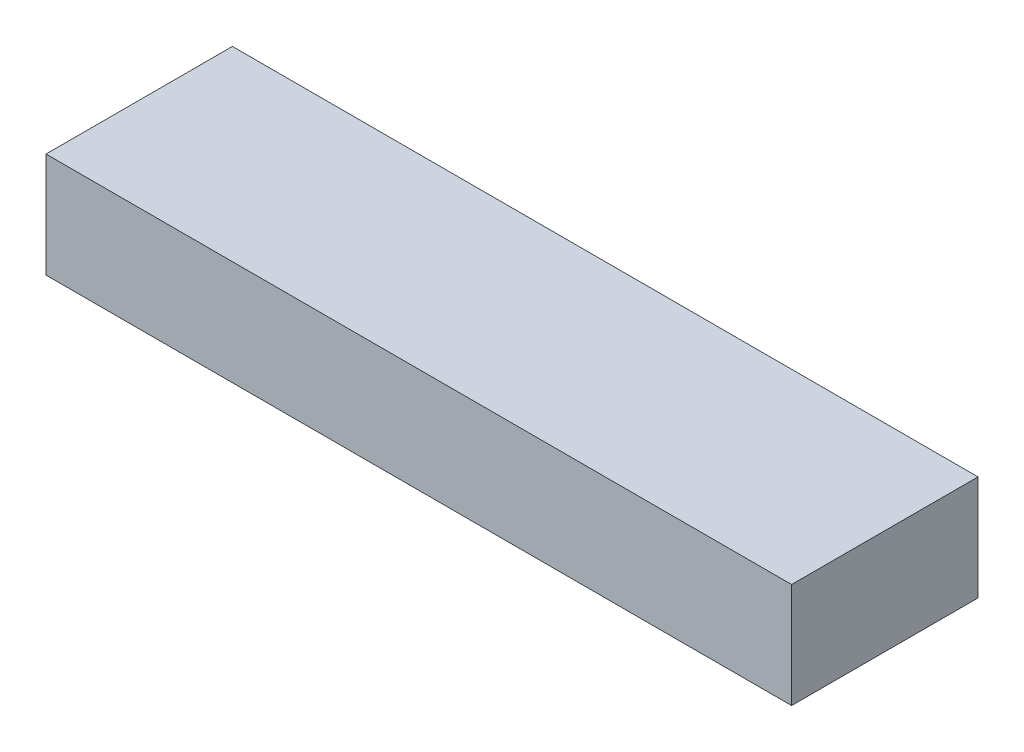
from build123d import *

# Parameters (mm, degrees)
SKETCH1_W           = 101.6
SKETCH1_H           = 25.4
BOSS_EXTRUDE1_DEPTH = 14.2875


with BuildPart() as part:
    # Sketch1 → Boss-Extrude1 (new body)
    with BuildSketch(Plane(origin=(0, 0, 0), x_dir=(1, 0, 0), z_dir=(0, 1, 0))):
        with Locations((-50.8, -12.7)):
            Rectangle(SKETCH1_W, SKETCH1_H)
    extrude(amount=BOSS_EXTRUDE1_DEPTH)


solid = part.part
